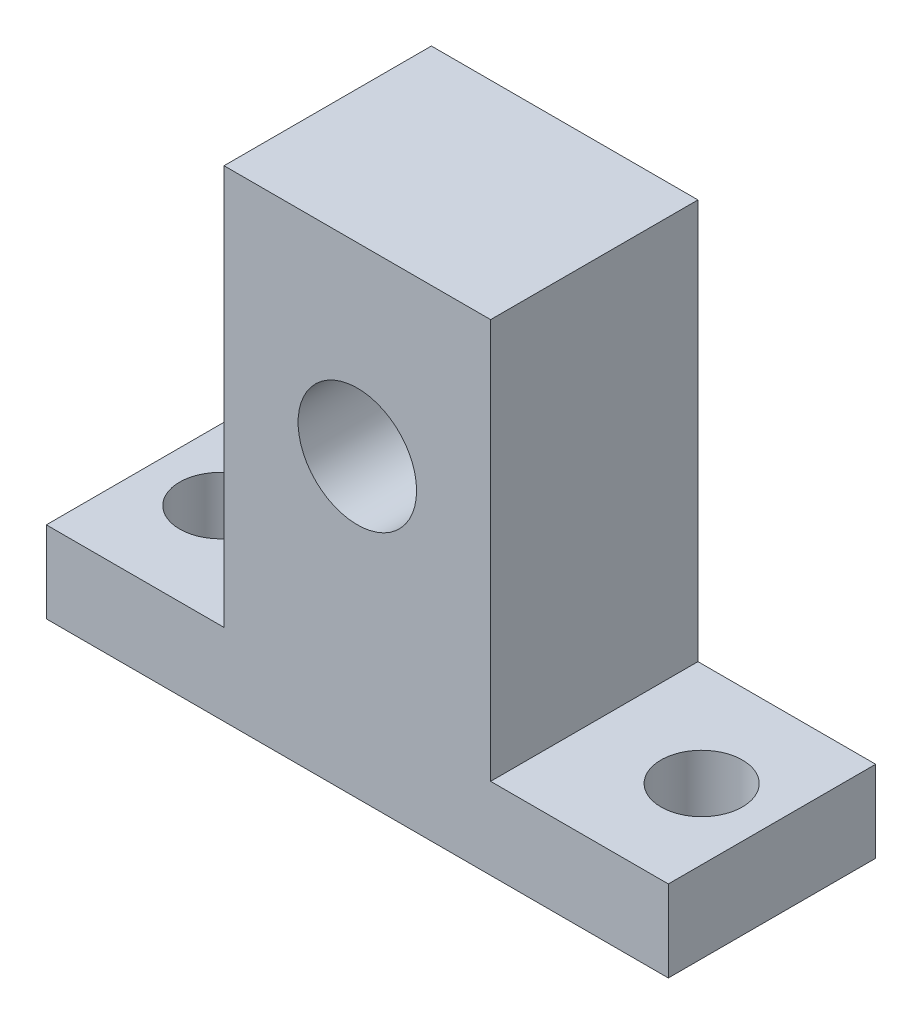
from build123d import *

# Parameters (mm, degrees)
SKETCH_1_R          = 4
EXTRUDE_1_DEPTH     = 14
SKETCH_2_R          = 2.75
CUT_EXTRUDE_1_DEPTH = 14


with BuildPart() as part:
    # 草图1 → 凸台-拉伸1 (new body)
    with BuildSketch(Plane.XY):
        Polygon((-21, -10.75), (-9, -10.75), (-9, 16.25), (9, 16.25), (9, -10.75), (21, -10.75), (21, -16.25), (-21, -16.25), align=None)
        with Locations((0, 3.75)):
            Circle(SKETCH_1_R, mode=Mode.SUBTRACT)
    extrude(amount=EXTRUDE_1_DEPTH)

    # 草图2 → 切除-拉伸1 (cut)
    with BuildSketch(Plane(origin=(0, -10.75, 0), x_dir=(1, 0, 0), z_dir=(0, 1, 0))):
        with Locations(Location((-16.25, -7, 0), (0, 0, 270))):
            Circle(SKETCH_2_R)
        with Locations(Location((16.25, -7, 0), (0, 0, 270))):
            Circle(SKETCH_2_R)
    extrude(amount=-CUT_EXTRUDE_1_DEPTH, mode=Mode.SUBTRACT)


solid = part.part
